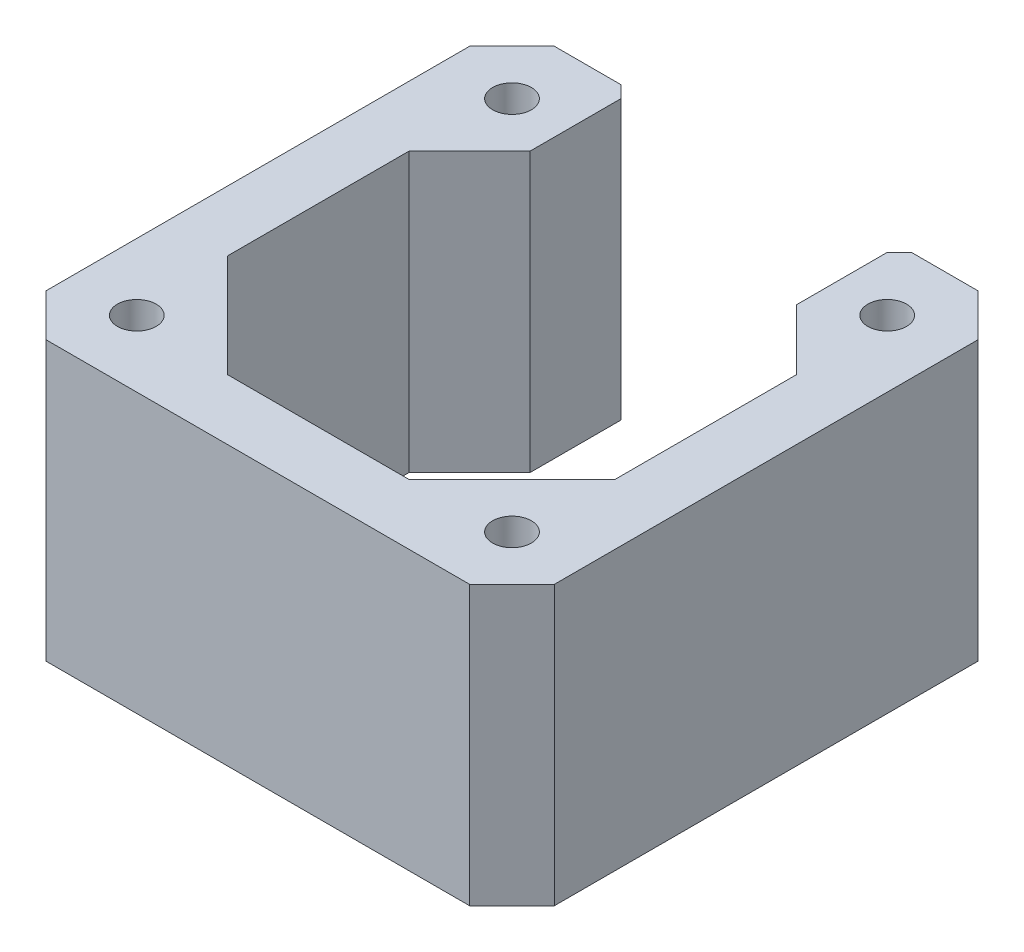
from build123d import *

# Parameters (mm, degrees)
BASE_DEPTH      = 23
BASE_DEPTH_BACK = 0.0001
SKETCH1_R       = 1.6


with BuildPart() as part:
    # Sketch1 → Base (new, two sides: drawn at the far end of the back side and taken through both)
    with BuildSketch(Plane(origin=(0, 0, 0), x_dir=(1, 0, 0), z_dir=(0, 1, 0)).offset(-BASE_DEPTH_BACK)):
        Polygon((-16, -7.499999998), (-7.5, -15.999999998), (7.5, -15.999999998), (16, -7.499999998), (16, 7.500000002), (10.999999997, 12.500000005), (11, 20.000000005), (12, 21.000000005), (17.500000004, 21.000000005), (21, 17.500000009), (21, -17.499999998), (17.5, -20.999999998), (-17.5, -20.999999998), (-21, -17.499999998), (-21, 17.500000009), (-17.500000004, 21.000000005), (-12, 21.000000005), (-11, 20.000000005), (-10.999999997, 12.500000005), (-16, 7.500000002), align=None)
        with Locations(Location((-15.500000002, 15.5, 0), (0, 0, 270))):
            Circle(SKETCH1_R, mode=Mode.SUBTRACT)
        with Locations(Location((-15.500000002, -15.5, 0), (0, 0, 270))):
            Circle(SKETCH1_R, mode=Mode.SUBTRACT)
        with Locations(Location((15.500000002, -15.5, 0), (0, 0, 90))):
            Circle(SKETCH1_R, mode=Mode.SUBTRACT)
        with Locations(Location((15.500000002, 15.5, 0), (0, 0, 90))):
            Circle(SKETCH1_R, mode=Mode.SUBTRACT)
    extrude(amount=BASE_DEPTH + BASE_DEPTH_BACK)


solid = part.part
